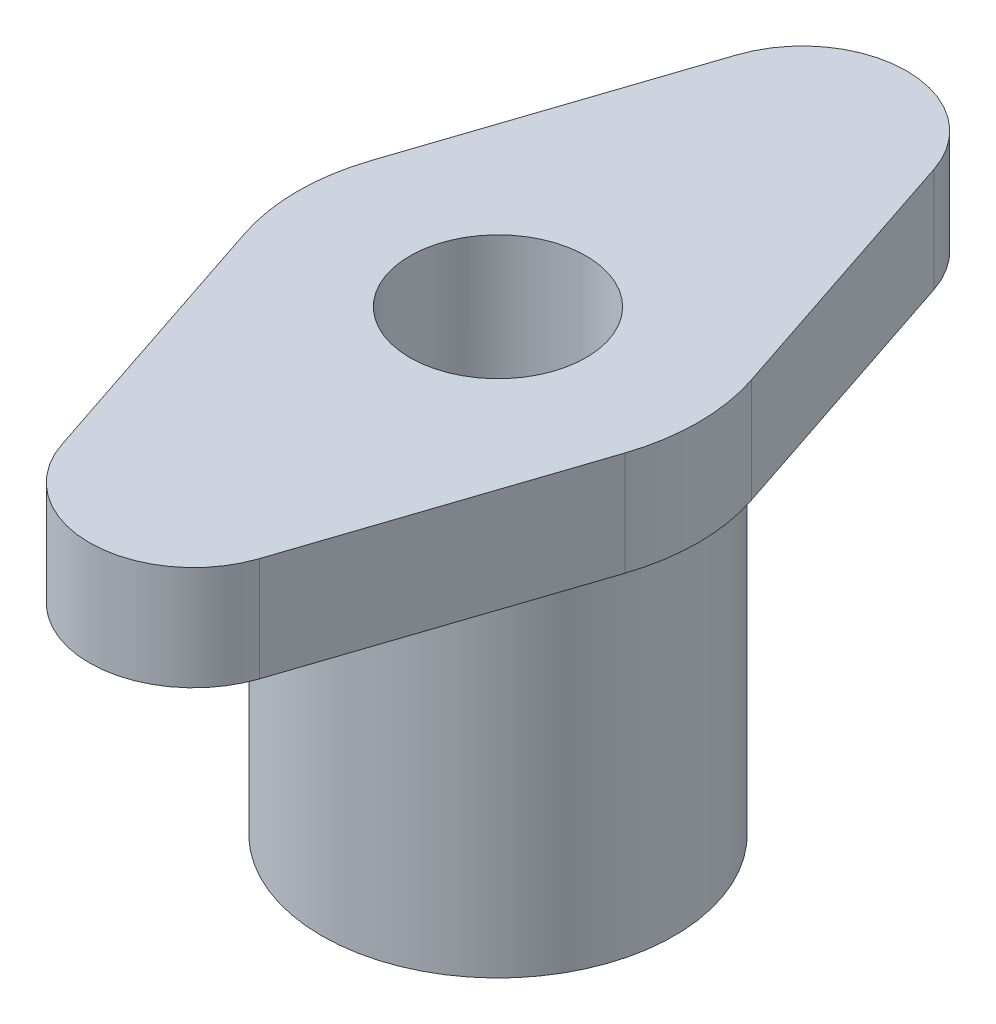
from build123d import *

# Parameters (mm, degrees)
SKETCH1_R           = 22
BOSS_EXTRUDE1_DEPTH = 44
BOSS_EXTRUDE2_DEPTH = 13
HOLE1_D             = 22


with BuildPart() as part:
    # Sketch1 → Boss-Extrude1 (new body)
    with BuildSketch(Plane(origin=(0, 0, 0), x_dir=(1, 0, 0), z_dir=(0, 1, 0))):
        with Locations(Location((0, 0, 0), (0, 0, 270))):
            Circle(SKETCH1_R)
    extrude(amount=BOSS_EXTRUDE1_DEPTH)

    # Sketch2 → Boss-Extrude2 (add)
    with BuildSketch(Plane(origin=(0, 44, 0), x_dir=(1, 0, 0), z_dir=(0, 1, 0))):
        with BuildLine():
            Line((-12.334780679, 42.105263158), (-23.720732075, 7.894736842))
            ThreePointArc((-23.720732075, 7.894736842), (-25, 0), (-23.720732075, -7.894736842))
            Line((-23.720732075, -7.894736842), (-12.334780679, -42.105263158))
            ThreePointArc((-12.334780679, -42.105263158), (0, -51), (12.334780679, -42.105263158))
            Line((12.334780679, -42.105263158), (23.720732075, -7.894736842))
            ThreePointArc((23.720732075, -7.894736842), (25, 0), (23.720732075, 7.894736842))
            Line((23.720732075, 7.894736842), (12.334780679, 42.105263158))
            ThreePointArc((12.334780679, 42.105263158), (0, 51), (-12.334780679, 42.105263158))
        make_face()
    extrude(amount=BOSS_EXTRUDE2_DEPTH)

    # Hole1 (through all)
    with Locations(Plane(origin=(0, 57, 0), x_dir=(1, 0, 0), z_dir=(0, 1, 0))):
        with Locations((0, 0)):
            Hole(HOLE1_D / 2)

    # Sketch5 → Cut-Revolve1 (revolve, cut)
    with BuildSketch(Plane(origin=(0, 0, 0), x_dir=(0, 0, -1), z_dir=(1, 0, 0)), mode=Mode.PRIVATE) as cut_revolve1_sk:
        Polygon((0, 0), (0, 6.350852961), (-11, 6.350852961), (-22, 0), align=None)
    revolve(cut_revolve1_sk.sketch.rotate(Axis((0, 0, 0), (0, 1, 0)), 180), axis=Axis((0, 0, 0), (0, 1, 0)), mode=Mode.SUBTRACT)


solid = part.part
